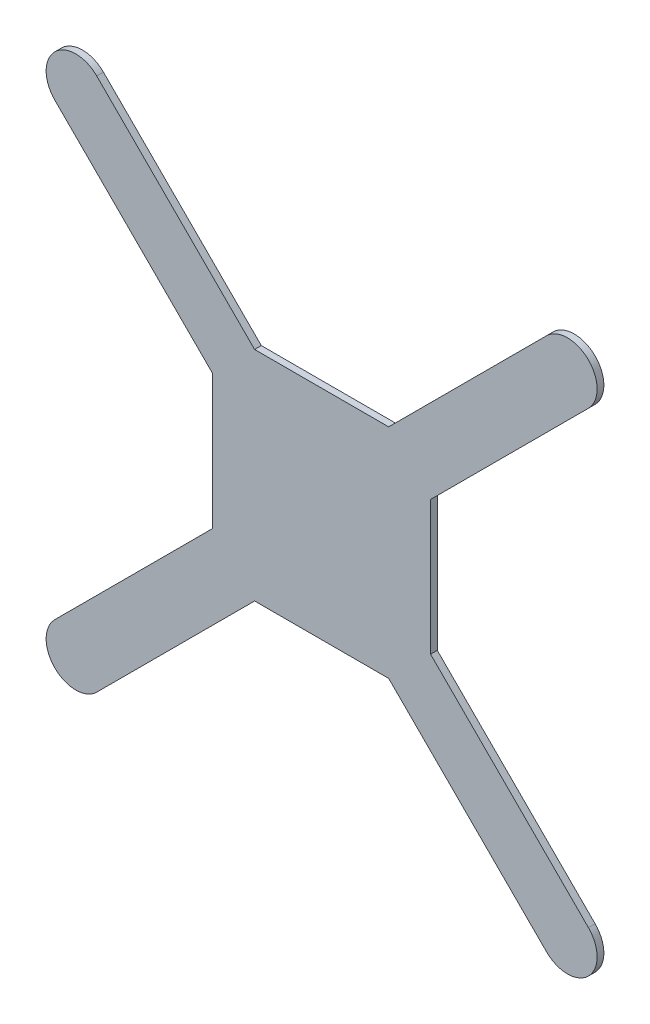
from build123d import *

# Parameters (mm, degrees)
EXTRUDE_1_DEPTH = 4


with BuildPart() as part:
    # 草图1 → 凸台-拉伸1 (new body)
    with BuildSketch(Plane.XY):
        with BuildLine():
            ThreePointArc((-134.224657096, -159.224657096), (-159.224657096, -159.224657096), (-159.224657096, -134.224657096))
            Line((-159.224657096, -134.224657096), (-65, -40))
            Line((-65, -40), (-40, -65))
            Line((-40, -65), (-134.224657096, -159.224657096))
        make_face()
        with BuildLine():
            Line((-40, 65), (-134.224657096, 159.224657096))
            ThreePointArc((-134.224657096, 159.224657096), (-159.224657096, 159.224657096), (-159.224657096, 134.224657096))
            Line((-159.224657096, 134.224657096), (-65, 40))
            Line((-65, 40), (-40, 65))
        make_face()
        Polygon((-65, 40), (-65, -40), (-40, -65), (40, -65), (65, -40), (65, 40), (40, 65), (-40, 65), align=None)
        with BuildLine():
            Line((40, -65), (134.224657096, -159.224657096))
            ThreePointArc((134.224657096, -159.224657096), (159.224657096, -159.224657096), (159.224657096, -134.224657096))
            Line((159.224657096, -134.224657096), (65, -40))
            Line((65, -40), (40, -65))
        make_face()
        with BuildLine():
            ThreePointArc((134.224657096, 159.224657096), (159.224657096, 159.224657096), (159.224657096, 134.224657096))
            Line((159.224657096, 134.224657096), (65, 40))
            Line((65, 40), (40, 65))
            Line((40, 65), (134.224657096, 159.224657096))
        make_face()
    extrude(amount=EXTRUDE_1_DEPTH)


solid = part.part
